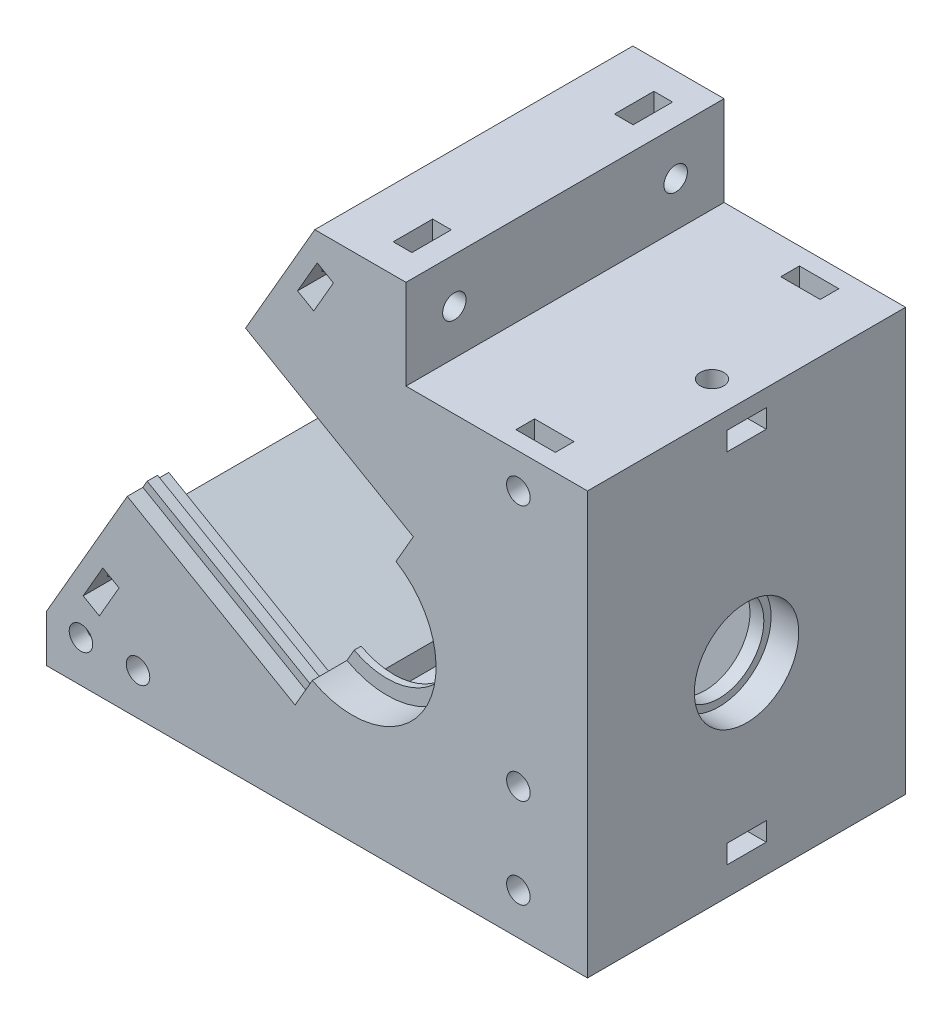
from build123d import *

# Parameters (mm, degrees)
SKETCH1_R           = 12.1
BOSS_EXTRUDE1_DEPTH = 6
BOSS_EXTRUDE2_DEPTH = 40
BOSS_EXTRUDE3_START = 40
SKETCH1_4_R         = 12.1
BOSS_EXTRUDE3_DEPTH = 6
BOSS_EXTRUDE4_START = 5
SKETCH1_5_R         = 12.1
SKETCH1_5_R_2       = 10
BOSS_EXTRUDE4_DEPTH = 1
BOSS_EXTRUDE5_START = 40
SKETCH1_6_R         = 12.1
SKETCH1_6_R_2       = 10
BOSS_EXTRUDE5_DEPTH = 1
SKETCH2_W           = 30
SKETCH2_H           = 34
CUT_EXTRUDE1_DEPTH  = 10
CUT_EXTRUDE2_DEPTH  = 49
SKETCH4_W           = 1.5
SKETCH4_H           = 1.25
BOSS_EXTRUDE6_DEPTH = 28.012812921
CUT_EXTRUDE3_DEPTH  = 49
CUT_EXTRUDE4_START  = -2
CUT_EXTRUDE4_DEPTH  = 4
SKETCH6_R           = 1.7
CUT_EXTRUDE5_DEPTH  = 8
SKETCH7_W           = 78.25
SKETCH7_H           = 4
CUT_EXTRUDE6_DEPTH  = 64
SKETCH8_R           = 1.7
CUT_EXTRUDE7_DEPTH  = 10
CUT_EXTRUDE9_START  = -36
SKETCH8_2_R         = 1.7
CUT_EXTRUDE9_DEPTH  = 10
SKETCH10_W          = 5.7
SKETCH10_H          = 2.7
CUT_EXTRUDE10_DEPTH = 8.5
CUT_EXTRUDE12_START = -78.25
SKETCH11_W          = 2.7
SKETCH11_H          = 5.7
SKETCH11_W_2        = 2.5
CUT_EXTRUDE12_DEPTH = 8.5
CUT_EXTRUDE13_START = -78.25
SKETCH10_2_W        = 5.7
SKETCH10_2_H        = 2.7
CUT_EXTRUDE13_DEPTH = 8.5
CUT_EXTRUDE14_DEPTH = 7.5
CUT_EXTRUDE15_START = -46
CUT_EXTRUDE15_DEPTH = 7.5
SKETCH13_R          = 1.7
CUT_EXTRUDE16_DEPTH = 10
SKETCH14_W          = 2.7
SKETCH14_H          = 5.7
CUT_EXTRUDE17_DEPTH = 10
SKETCH17_R          = 1.7
CUT_EXTRUDE19_DEPTH = 20
CUT_EXTRUDE20_START = -26
SKETCH17_2_R        = 1.7
CUT_EXTRUDE20_DEPTH = 20
SKETCH19_W          = 78.25
SKETCH19_H          = 46
BOSS_EXTRUDE7_DEPTH = 1
SKETCH9_R           = 1.7
CUT_EXTRUDE8_DEPTH  = 10
SKETCH22_W          = 5.7
SKETCH22_H          = 2.7
CUT_EXTRUDE22_DEPTH = 9.5
SKETCH23_R          = 1.7
CUT_EXTRUDE23_DEPTH = 12
CUT_EXTRUDE24_START = -34
SKETCH23_2_R        = 1.7
CUT_EXTRUDE24_DEPTH = 12
CUT_EXTRUDE25_START = -8.5
SKETCH24_R          = 1.7
SKETCH24_W          = 5.7
SKETCH24_H          = 2.7
CUT_EXTRUDE25_DEPTH = 8.5
SKETCH26_W          = 5.7
SKETCH26_H          = 2.7
CUT_EXTRUDE27_DEPTH = 8.5
CUT_EXTRUDE28_DEPTH = 3
CUT_EXTRUDE29_START = 34
CUT_EXTRUDE29_DEPTH = 3


with BuildPart() as part:
    # Sketch1 → Boss-Extrude1 (new body)
    with BuildSketch(Plane.XY):
        Polygon((-15, -31), (-15, -27.5), (15, -27.5), (15, -31), (34, -31), (34, 33), (7.75, 33), (7.75, 46), (-5.441887617, 46), (-44.25, -21.217622393), (-44.25, -31), align=None)
        Circle(SKETCH1_R, mode=Mode.SUBTRACT)
    extrude(amount=BOSS_EXTRUDE1_DEPTH)

    # Sketch1<3> → Boss-Extrude2 (add)
    with BuildSketch(Plane.XY):
        with BuildLine():
            ThreePointArc((16.8, -22.4), (11.324740428, -25.607621019), (5.267826876, -27.5))
            Line((5.267826876, -27.5), (15, -27.5))
            Line((15, -27.5), (15, -31))
            Line((15, -31), (34, -31))
            Line((34, -31), (34, 33))
            Line((34, 33), (7.75, 33))
            Line((7.75, 33), (-1.15767665, 33))
            Line((-1.15767665, 33), (14, 24.248711306))
            ThreePointArc((14, 24.248711306), (15.427716402, 23.366334043), (16.8, 22.4))
            Line((16.8, 22.4), (28, 14))
            Line((28, 14), (28, 10))
            Line((28, 10), (28, 0))
            Line((28, 0), (28, -10))
            Line((28, -10), (28, -14))
            Line((28, -14), (16.8, -22.4))
        make_face()
        Polygon((-10, 38.105117767), (-1.15767665, 33), (7.75, 33), (7.75, 46), (-5.25, 46), (-5.441887617, 46), align=None)
        with BuildLine():
            ThreePointArc((-5.267826876, -27.5), (-9.770107864, -26.240140859), (-14, -24.248711306))
            Line((-14, -24.248711306), (-38, -10.392304845))
            Line((-38, -10.392304845), (-38, -31))
            Line((-38, -31), (-15, -31))
            Line((-15, -31), (-15, -27.5))
            Line((-15, -27.5), (-5.267826876, -27.5))
        make_face()
        Polygon((-38, -31), (-38, -10.392304845), (-44.25, -21.217622393), (-44.25, -31), align=None)
    extrude(amount=BOSS_EXTRUDE2_DEPTH)

    # Sketch1<4> → Boss-Extrude3 (add)
    with BuildSketch(Plane.XY.offset(BOSS_EXTRUDE3_START)):
        Polygon((-15, -31), (-15, -27.5), (15, -27.5), (15, -31), (34, -31), (34, 33), (7.75, 33), (7.75, 46), (-5.441887617, 46), (-44.25, -21.217622393), (-44.25, -31), align=None)
        Circle(SKETCH1_4_R, mode=Mode.SUBTRACT)
    extrude(amount=BOSS_EXTRUDE3_DEPTH)

    # Sketch1<5> → Boss-Extrude4 (add)
    with BuildSketch(Plane.XY.offset(BOSS_EXTRUDE4_START)):
        Circle(SKETCH1_5_R)
        Circle(SKETCH1_5_R_2, mode=Mode.SUBTRACT)
    extrude(amount=BOSS_EXTRUDE4_DEPTH)

    # Sketch1<6> → Boss-Extrude5 (add)
    with BuildSketch(Plane.XY.offset(BOSS_EXTRUDE5_START)):
        Circle(SKETCH1_6_R)
        Circle(SKETCH1_6_R_2, mode=Mode.SUBTRACT)
    extrude(amount=BOSS_EXTRUDE5_DEPTH)

    # Sketch2 → Cut-Extrude1 (cut)
    with BuildSketch(Plane.XZ.offset(27.5)):
        with Locations((0, 23)):
            Rectangle(SKETCH2_W, SKETCH2_H)
    extrude(amount=-CUT_EXTRUDE1_DEPTH, mode=Mode.SUBTRACT)

    # Sketch3 → Cut-Extrude2 (cut)
    with BuildSketch(Plane(origin=(0, 0, 0), x_dir=(-1, 0, 0), z_dir=(0, 0, -1))):
        Polygon((-8.55, 14.809034405), (-6.05, 10.478907386), (17.95, 24.335313846), (15.45, 28.665440865), align=None)
        with BuildLine():
            Line((17.95, 24.335313846), (-6.05, 10.478907386))
            ThreePointArc((-6.05, 10.478907386), (6.05, 10.478907386), (12.1, 0))
            ThreePointArc((12.1, 0), (10.478907386, -6.05), (6.05, -10.478907386))
            Line((6.05, -10.478907386), (30.05, 3.377499075))
            Line((30.05, 3.377499075), (17.95, 24.335313846))
        make_face()
        with BuildLine():
            ThreePointArc((12.1, 0), (6.05, 10.478907386), (-6.05, 10.478907386))
            Line((-6.05, 10.478907386), (6.05, -10.478907386))
            ThreePointArc((6.05, -10.478907386), (10.478907386, -6.05), (12.1, 0))
        make_face()
        with BuildLine():
            ThreePointArc((-6.307947831, 10.325686135), (-6.17944883, 10.403096278), (-6.05, 10.478907386))
            Line((-6.05, 10.478907386), (-8.55, 14.809034405))
            Line((-8.55, 14.809034405), (-8.809807621, 14.659034405))
            Line((-8.809807621, 14.659034405), (-6.307947831, 10.325686135))
        make_face()
        with BuildLine():
            Line((6.05, -10.478907386), (-6.05, 10.478907386))
            ThreePointArc((-6.05, 10.478907386), (-6.17944883, 10.403096278), (-6.307947831, 10.325686135))
            Line((-6.307947831, 10.325686135), (5.788332589, -10.625686135))
            ThreePointArc((5.788332589, -10.625686135), (5.91962124, -10.553107807), (6.05, -10.478907386))
        make_face()
        Polygon((30.05, 3.377499075), (6.05, -10.478907386), (8.55, -14.809034405), (32.55, -0.952627944), align=None)
        with BuildLine():
            Line((8.55, -14.809034405), (6.05, -10.478907386))
            ThreePointArc((6.05, -10.478907386), (5.91962124, -10.553107807), (5.788332589, -10.625686135))
            Line((5.788332589, -10.625686135), (8.290192379, -14.959034405))
            Line((8.290192379, -14.959034405), (8.55, -14.809034405))
        make_face()
    extrude(amount=-CUT_EXTRUDE2_DEPTH, mode=Mode.SUBTRACT)

    # Sketch4 → Boss-Extrude6 (add)
    with BuildSketch(Plane(origin=(0.259807621, -0.15, 0), x_dir=(0, 0, 1), z_dir=(-0.8660254037844324, 0.5000000000000109, 0))):
        with Locations((3, 16.475)):
            Rectangle(SKETCH4_W, SKETCH4_H)
        with Locations((43, 16.475)):
            Rectangle(SKETCH4_W, SKETCH4_H)
        with Locations((3, -16.475)):
            Rectangle(SKETCH4_W, SKETCH4_H)
        with Locations((43, -16.475)):
            Rectangle(SKETCH4_W, SKETCH4_H)
    extrude(amount=BOSS_EXTRUDE6_DEPTH)

    # Sketch5 → Cut-Extrude3 (cut)
    with BuildSketch(Plane.ZY.offset(-28)):
        with BuildLine():
            ThreePointArc((29.5, 0), (29.118171804, 2.194988331), (28.017546532, 4.132097144))
            Line((28.017546532, 4.132097144), (17.982453468, -4.132097144))
            ThreePointArc((17.982453468, -4.132097144), (25.194988331, -6.118171804), (29.5, 0))
        make_face()
        with BuildLine():
            Line((17.982453468, -4.132097144), (28.017546532, 4.132097144))
            ThreePointArc((28.017546532, 4.132097144), (18.867902856, 5.017546532), (17.982453468, -4.132097144))
        make_face()
    extrude(amount=-CUT_EXTRUDE3_DEPTH, mode=Mode.SUBTRACT)

    # Sketch5<3> → Cut-Extrude4 (cut)
    with BuildSketch(Plane.ZY.offset(-28).offset(CUT_EXTRUDE4_START)):
        with BuildLine():
            ThreePointArc((30.55, 0), (30.106491865, 2.549563369), (28.828073279, 4.799589759))
            Line((28.828073279, 4.799589759), (28.017546532, 4.132097144))
            ThreePointArc((28.017546532, 4.132097144), (29.118171804, 2.194988331), (29.5, 0))
            ThreePointArc((29.5, 0), (25.194988331, -6.118171804), (17.982453468, -4.132097144))
            Line((17.982453468, -4.132097144), (17.171926721, -4.799589759))
            ThreePointArc((17.171926721, -4.799589759), (25.549563369, -7.106491865), (30.55, 0))
        make_face()
        with BuildLine():
            Line((28.017546532, 4.132097144), (28.828073279, 4.799589759))
            ThreePointArc((28.828073279, 4.799589759), (18.200410241, 5.828073279), (17.171926721, -4.799589759))
            Line((17.171926721, -4.799589759), (17.982453468, -4.132097144))
            ThreePointArc((17.982453468, -4.132097144), (18.867902856, 5.017546532), (28.017546532, 4.132097144))
        make_face()
    extrude(amount=-CUT_EXTRUDE4_DEPTH, mode=Mode.SUBTRACT)

    # Sketch6 → Cut-Extrude5 (cut)
    with BuildSketch(Plane(origin=(-24, 13.856406461, 0), x_dir=(0, 0, 1), z_dir=(-0.8660254037844418, 0.4999999999999945, 0))):
        with Locations(Location((4, -31, 0), (0, 0, 270))):
            Circle(SKETCH6_R)
        with Locations(Location((42, -31, 0), (0, 0, 270))):
            Circle(SKETCH6_R)
        with Locations(Location((42, 31, 0), (0, 0, 270))):
            Circle(SKETCH6_R)
        with Locations(Location((4, 31, 0), (0, 0, 270))):
            Circle(SKETCH6_R)
    extrude(amount=-CUT_EXTRUDE5_DEPTH, mode=Mode.SUBTRACT)

    # Sketch7 → Cut-Extrude6 (cut)
    with BuildSketch(Plane.XY.offset(46)):
        with Locations((-5.125, -29)):
            Rectangle(SKETCH7_W, SKETCH7_H)
    extrude(amount=-CUT_EXTRUDE6_DEPTH, mode=Mode.SUBTRACT)

    # Sketch8 → Cut-Extrude7 (cut)
    with BuildSketch(Plane.XY.offset(46)):
        with Locations((-39.25, -22)):
            Circle(SKETCH8_R)
    extrude(amount=-CUT_EXTRUDE7_DEPTH, mode=Mode.SUBTRACT)

    # Sketch8<2> → Cut-Extrude9 (cut)
    with BuildSketch(Plane.XY.offset(46).offset(CUT_EXTRUDE9_START)):
        with Locations((-39.25, -22)):
            Circle(SKETCH8_2_R)
    extrude(amount=-CUT_EXTRUDE9_DEPTH, mode=Mode.SUBTRACT)

    # Sketch10 → Cut-Extrude10 (cut)
    with BuildSketch(Plane.ZY.offset(44.25)):
        with Locations((23, -22.567622393)):
            Rectangle(SKETCH10_W, SKETCH10_H)
    extrude(amount=-CUT_EXTRUDE10_DEPTH, mode=Mode.SUBTRACT)

    # Sketch11 → Cut-Extrude12 (cut)
    with BuildSketch(Plane(origin=(34, 0, 0), x_dir=(0, 0, -1), z_dir=(1, 0, 0)).offset(CUT_EXTRUDE12_START)):
        with Locations((-42.35, -22)):
            Rectangle(SKETCH11_W, SKETCH11_H)
        with Locations((-3.75, -22)):
            Rectangle(SKETCH11_W_2, SKETCH11_H)
    extrude(amount=CUT_EXTRUDE12_DEPTH, mode=Mode.SUBTRACT)

    # Sketch10<2> → Cut-Extrude13 (cut)
    with BuildSketch(Plane.ZY.offset(44.25).offset(CUT_EXTRUDE13_START)):
        with Locations((23, -22.567622393)):
            Rectangle(SKETCH10_2_W, SKETCH10_2_H)
    extrude(amount=CUT_EXTRUDE13_DEPTH, mode=Mode.SUBTRACT)

    # Sketch12 → Cut-Extrude14 (cut)
    with BuildSketch(Plane.XY.offset(46)):
        Polygon((-36.083141571, -11.672208656), (-38.933141571, -16.608553458), (-36.594872981, -17.958553458), (-33.744872981, -13.022208656), align=None)
        Polygon((-5.083141571, 42.021366379), (-7.933141571, 37.085021577), (-5.594872981, 35.735021577), (-2.744872981, 40.671366379), align=None)
    extrude(amount=-CUT_EXTRUDE14_DEPTH, mode=Mode.SUBTRACT)

    # Sketch12<2> → Cut-Extrude15 (cut)
    with BuildSketch(Plane.XY.offset(46).offset(CUT_EXTRUDE15_START)):
        Polygon((-36.083141571, -11.672208656), (-38.933141571, -16.608553458), (-36.594872981, -17.958553458), (-33.744872981, -13.022208656), align=None)
        Polygon((-5.083141571, 42.021366379), (-7.933141571, 37.085021577), (-5.594872981, 35.735021577), (-2.744872981, 40.671366379), align=None)
    extrude(amount=CUT_EXTRUDE15_DEPTH, mode=Mode.SUBTRACT)

    # Sketch13 → Cut-Extrude16 (cut)
    with BuildSketch(Plane(origin=(7.75, 0, 0), x_dir=(0, 0, -1), z_dir=(1, 0, 0))):
        with Locations((-39, 39.5)):
            Circle(SKETCH13_R)
        with Locations((-7, 39.5)):
            Circle(SKETCH13_R)
    extrude(amount=-CUT_EXTRUDE16_DEPTH, mode=Mode.SUBTRACT)

    # Sketch14 → Cut-Extrude17 (cut)
    with BuildSketch(Plane(origin=(0, 46, 0), x_dir=(1, 0, 0), z_dir=(0, 1, 0))):
        with Locations((3.1, -7)):
            Rectangle(SKETCH14_W, SKETCH14_H)
        with Locations((3.1, -39)):
            Rectangle(SKETCH14_W, SKETCH14_H)
    extrude(amount=-CUT_EXTRUDE17_DEPTH, mode=Mode.SUBTRACT)

    # Sketch17 → Cut-Extrude19 (cut)
    with BuildSketch(Plane.XY.offset(46)):
        with Locations((-31, -22)):
            Circle(SKETCH17_R)
        with Locations((24, -22)):
            Circle(SKETCH17_R)
    extrude(amount=-CUT_EXTRUDE19_DEPTH, mode=Mode.SUBTRACT)

    # Sketch17<2> → Cut-Extrude20 (cut)
    with BuildSketch(Plane.XY.offset(46).offset(CUT_EXTRUDE20_START)):
        with Locations((-31, -22)):
            Circle(SKETCH17_2_R)
        with Locations((24, -22)):
            Circle(SKETCH17_2_R)
    extrude(amount=-CUT_EXTRUDE20_DEPTH, mode=Mode.SUBTRACT)

    # Sketch19 → Boss-Extrude7 (add)
    with BuildSketch(Plane.XZ.offset(27)):
        with Locations((-5.125, 23)):
            Rectangle(SKETCH19_W, SKETCH19_H)
    extrude(amount=BOSS_EXTRUDE7_DEPTH)

    # Sketch9 → Cut-Extrude8 (cut)
    with BuildSketch(Plane.XZ.offset(28)):
        with Locations(Location((-39.25, 23, 0), (0, 0, 270))):
            Circle(SKETCH9_R)
        with Locations(Location((29, 23, 0), (0, 0, 270))):
            Circle(SKETCH9_R)
    extrude(amount=-CUT_EXTRUDE8_DEPTH, mode=Mode.SUBTRACT)

    # Sketch22 → Cut-Extrude22 (cut)
    with BuildSketch(Plane.XZ.offset(28)):
        with Locations((24, 3.85)):
            Rectangle(SKETCH22_W, SKETCH22_H)
        with Locations((-31, 3.85)):
            Rectangle(SKETCH22_W, SKETCH22_H)
        with Locations((-31, 42.15)):
            Rectangle(SKETCH22_W, SKETCH22_H)
        with Locations((24, 42.15)):
            Rectangle(SKETCH22_W, SKETCH22_H)
    extrude(amount=-CUT_EXTRUDE22_DEPTH, mode=Mode.SUBTRACT)

    # Sketch23 → Cut-Extrude23 (cut)
    with BuildSketch(Plane.XY.offset(46)):
        with Locations((24, 28)):
            Circle(SKETCH23_R)
        with Locations((24, -9)):
            Circle(SKETCH23_R)
    extrude(amount=-CUT_EXTRUDE23_DEPTH, mode=Mode.SUBTRACT)

    # Sketch23<2> → Cut-Extrude24 (cut)
    with BuildSketch(Plane.XY.offset(46).offset(CUT_EXTRUDE24_START)):
        with Locations((24, 28)):
            Circle(SKETCH23_2_R)
        with Locations((24, -9)):
            Circle(SKETCH23_2_R)
    extrude(amount=-CUT_EXTRUDE24_DEPTH, mode=Mode.SUBTRACT)

    # Sketch24 → Cut-Extrude25 (cut)
    with BuildSketch(Plane(origin=(0, 33, 0), x_dir=(1, 0, 0), z_dir=(0, 1, 0)).offset(CUT_EXTRUDE25_START)):
        with Locations(Location((29, -23, 0), (0, 0, 90))):
            Circle(SKETCH24_R)
        with Locations((24, -42.15)):
            Rectangle(SKETCH24_W, SKETCH24_H)
        with Locations((24, -3.85)):
            Rectangle(SKETCH24_W, SKETCH24_H)
    extrude(amount=CUT_EXTRUDE25_DEPTH, mode=Mode.SUBTRACT)

    # Sketch26 → Cut-Extrude27 (cut)
    with BuildSketch(Plane(origin=(34, 0, 0), x_dir=(0, 0, -1), z_dir=(1, 0, 0))):
        with Locations((-23, 29.15)):
            Rectangle(SKETCH26_W, SKETCH26_H)
    extrude(amount=-CUT_EXTRUDE27_DEPTH, mode=Mode.SUBTRACT)

    # Sketch27 → Cut-Extrude28 (cut)
    with BuildSketch(Plane.XY.offset(6)):
        Polygon((24, -12.290896534), (26.85, -10.645448267), (26.85, -7.354551733), (24, -5.709103466), (21.15, -7.354551733), (21.15, -10.645448267), align=None)
    extrude(amount=-CUT_EXTRUDE28_DEPTH, mode=Mode.SUBTRACT)

    # Sketch27<2> → Cut-Extrude29 (cut)
    with BuildSketch(Plane.XY.offset(6).offset(CUT_EXTRUDE29_START)):
        Polygon((24, -12.290896534), (26.85, -10.645448267), (26.85, -7.354551733), (24, -5.709103466), (21.15, -7.354551733), (21.15, -10.645448267), align=None)
    extrude(amount=CUT_EXTRUDE29_DEPTH, mode=Mode.SUBTRACT)


solid = part.part
